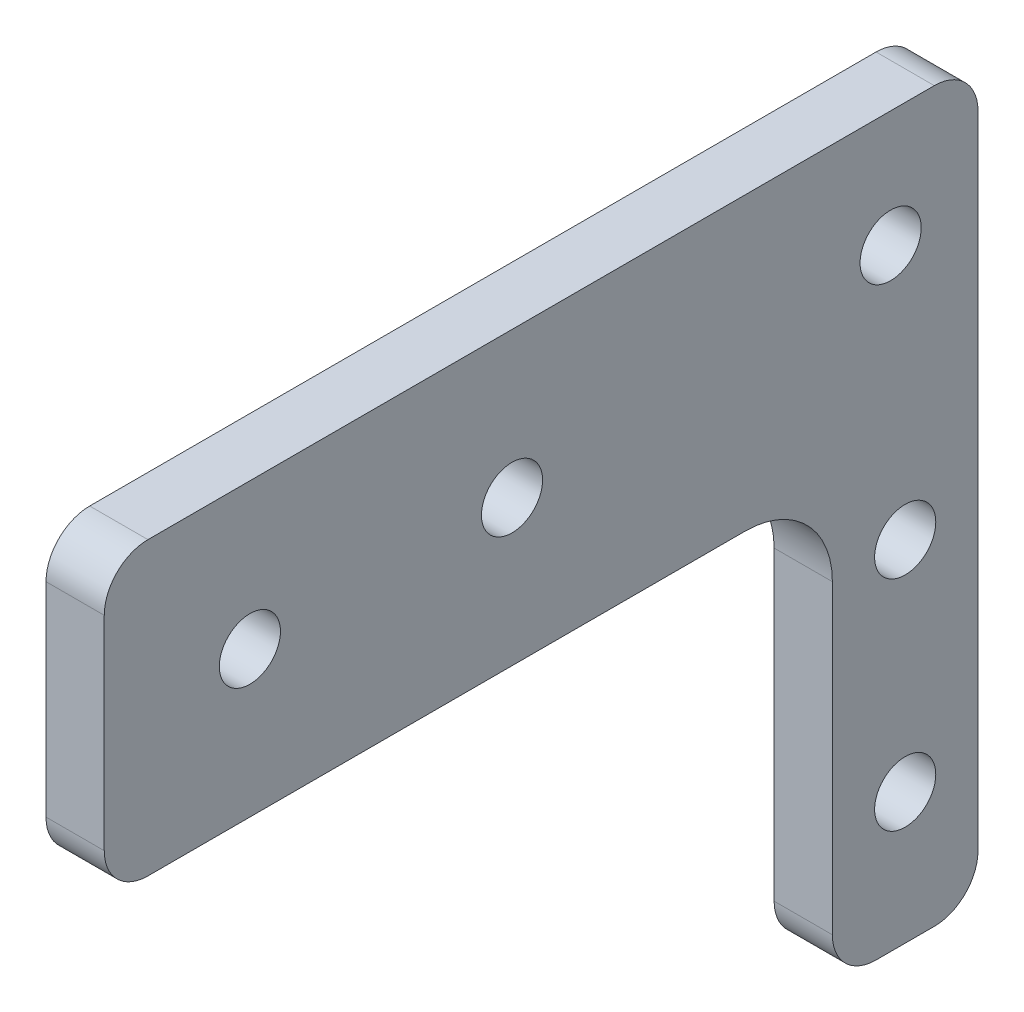
from build123d import *

# Parameters (mm, degrees)
EXTRUDE_1_DEPTH     = 4
SKETCH_3_R          = 2.1
CUT_EXTRUDE_1_DEPTH = 10


with BuildPart() as part:
    # 草图2 → 凸台-拉伸1 (new body)
    with BuildSketch(Plane(origin=(0, 0, 0), x_dir=(0, 0, -1), z_dir=(1, 0, 0))):
        with BuildLine():
            Line((-211.25, 80.041666667), (-157.25, 80.041666667))
            ThreePointArc((-157.25, 80.041666667), (-155.128679656, 79.16298701), (-154.25, 77.041666667))
            Line((-154.25, 77.041666667), (-154.25, 33.041666667))
            ThreePointArc((-154.25, 33.041666667), (-155.128679656, 30.920346323), (-157.25, 30.041666667))
            Line((-157.25, 30.041666667), (-161.25, 30.041666667))
            ThreePointArc((-161.25, 30.041666667), (-163.371320344, 30.920346323), (-164.25, 33.041666667))
            Line((-164.25, 33.041666667), (-164.25, 54.041666667))
            ThreePointArc((-164.25, 54.041666667), (-166.007359313, 58.284307354), (-170.25, 60.041666667))
            Line((-170.25, 60.041666667), (-211.25, 60.041666667))
            ThreePointArc((-211.25, 60.041666667), (-213.371320344, 60.920346323), (-214.25, 63.041666667))
            Line((-214.25, 63.041666667), (-214.25, 77.041666667))
            ThreePointArc((-214.25, 77.041666667), (-213.371320344, 79.16298701), (-211.25, 80.041666667))
        make_face()
    extrude(amount=EXTRUDE_1_DEPTH)

    # 草图3 → 切除-拉伸1 (cut)
    with BuildSketch(Plane(origin=(4, 0, 0), x_dir=(0, 0, -1), z_dir=(1, 0, 0))):
        with Locations((-204.25, 70.041666667)):
            Circle(SKETCH_3_R)
        with Locations((-186.25, 70.041666667)):
            Circle(SKETCH_3_R)
        with Locations((-159.25, 54.041666667)):
            Circle(SKETCH_3_R)
        with Locations((-159.25, 39.041666667)):
            Circle(SKETCH_3_R)
        with Locations((-160.25, 72.041666667)):
            Circle(SKETCH_3_R)
    extrude(amount=-CUT_EXTRUDE_1_DEPTH, mode=Mode.SUBTRACT)


solid = part.part
